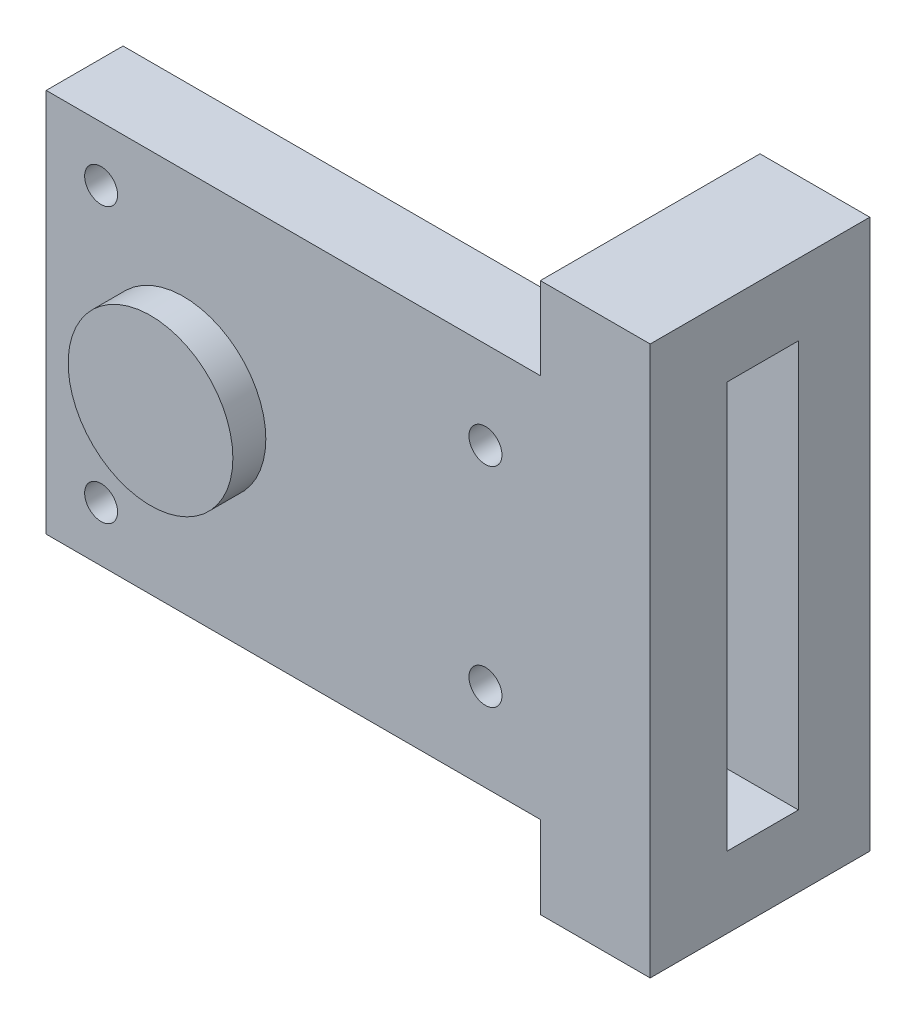
from build123d import *

# Parameters (mm, degrees)
SKETCH1_R           = 1.5
BOSS_EXTRUDE1_DEPTH = 7
SKETCH2_W           = 7
SKETCH2_H           = 50
BOSS_EXTRUDE2_DEPTH = 10
SKETCH3_W           = 10
SKETCH3_H           = 6.5
BOSS_EXTRUDE3_DEPTH = 6.5
SKETCH4_W           = 10
SKETCH4_H           = 50
BOSS_EXTRUDE4_DEPTH = 6.5
SKETCH5_R           = 7.5
BOSS_EXTRUDE5_DEPTH = 3
SKETCH1_3_R         = 4.25
CUT_EXTRUDE1_DEPTH  = 6


with BuildPart() as part:
    # Sketch1 → Boss-Extrude1 (new body)
    with BuildSketch(Plane.XY):
        Polygon((-47.5, 17.5), (-92.5, 17.5), (-92.5, 0), (-92.5, -17.5), (-47.5, -17.5), align=None)
        with Locations((-87.5, -12.5)):
            Circle(SKETCH1_R, mode=Mode.SUBTRACT)
        with Locations((-52.5, -9.5)):
            Circle(SKETCH1_R, mode=Mode.SUBTRACT)
        with Locations((-87.5, 12.5)):
            Circle(SKETCH1_R, mode=Mode.SUBTRACT)
        with Locations((-52.5, 9.5)):
            Circle(SKETCH1_R, mode=Mode.SUBTRACT)
    extrude(amount=BOSS_EXTRUDE1_DEPTH)

    # Sketch2 → Boss-Extrude2 (add)
    with BuildSketch(Plane(origin=(-47.5, 0, 0), x_dir=(0, 0, -1), z_dir=(1, 0, 0))):
        with Locations((-3.5, 0)):
            Rectangle(SKETCH2_W, SKETCH2_H)
    extrude(amount=BOSS_EXTRUDE2_DEPTH)

    # Sketch3 → Boss-Extrude3 (add)
    with BuildSketch(Plane(origin=(0, 0, 0), x_dir=(-1, 0, 0), z_dir=(0, 0, -1))):
        with Locations((42.5, 21.75)):
            Rectangle(SKETCH3_W, SKETCH3_H)
        with Locations((42.5, -21.75)):
            Rectangle(SKETCH3_W, SKETCH3_H)
    extrude(amount=BOSS_EXTRUDE3_DEPTH)

    # Sketch4 → Boss-Extrude4 (add)
    with BuildSketch(Plane(origin=(0, 0, -6.5), x_dir=(-1, 0, 0), z_dir=(0, 0, -1))):
        with Locations((42.5, 0)):
            Rectangle(SKETCH4_W, SKETCH4_H)
    extrude(amount=BOSS_EXTRUDE4_DEPTH)

    # Sketch5 → Boss-Extrude5 (add)
    with BuildSketch(Plane.XY.offset(7)):
        with Locations((-80, 0)):
            Circle(SKETCH5_R)
    extrude(amount=BOSS_EXTRUDE5_DEPTH)

    # Sketch1<3> → Cut-Extrude1 (cut)
    with BuildSketch(Plane.XY):
        with Locations((-80, 0)):
            Circle(SKETCH1_3_R)
    extrude(amount=CUT_EXTRUDE1_DEPTH, mode=Mode.SUBTRACT)


solid = part.part
